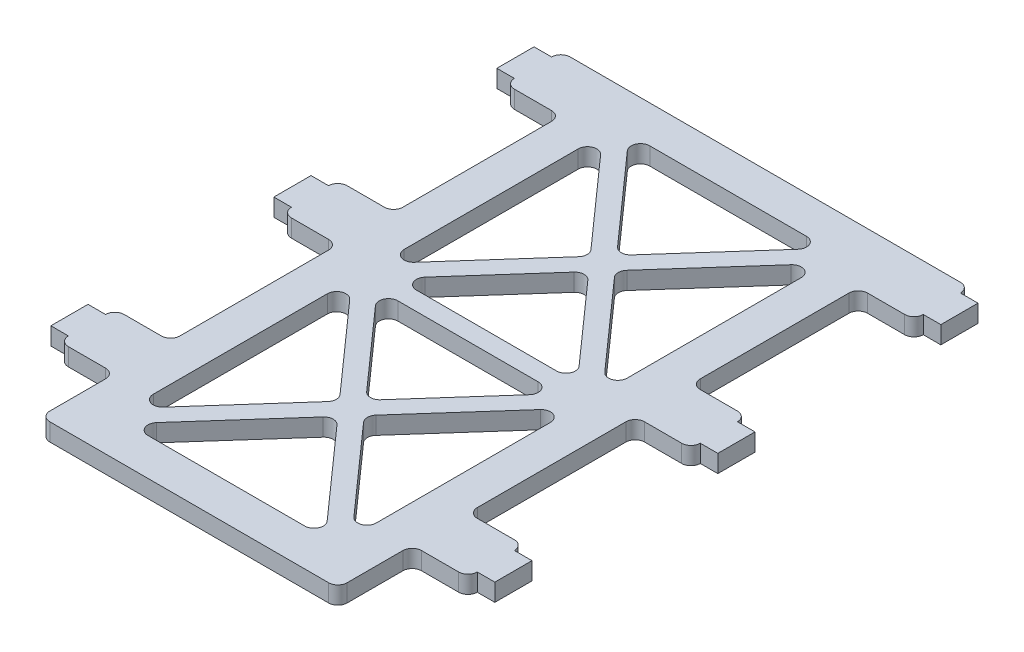
from build123d import *

# Parameters (mm, degrees)
SKETCH1_W           = 50.8
SKETCH1_H           = 98.425
BOSS_EXTRUDE1_DEPTH = 1.5
SKETCH2_W           = 9.525
SKETCH2_H           = 9.525
BOSS_EXTRUDE2_DEPTH = 3
CUT_EXTRUDE1_DEPTH  = 3
FILLET1_R           = 1.5875
SKETCH5_W           = 3
SKETCH5_H           = 6.35
BOSS_EXTRUDE3_DEPTH = 3


with BuildPart() as part:
    # Sketch1 → Boss-Extrude1 (new, symmetric)
    with BuildSketch(Plane(origin=(0, 34.29, 0), x_dir=(1, 0, 0), z_dir=(0, 1, 0))):
        with Locations((0, 120.65)):
            Rectangle(SKETCH1_W, SKETCH1_H)
    extrude(amount=BOSS_EXTRUDE1_DEPTH, both=True)

    # Sketch2 → Boss-Extrude2 (add)
    with BuildSketch(Plane(origin=(0, 35.79, 0), x_dir=(1, 0, 0), z_dir=(0, 1, 0))):
        with Locations((30.1625, 165.1)):
            Rectangle(SKETCH2_W, SKETCH2_H)
        with Locations((-30.1625, 165.1)):
            Rectangle(SKETCH2_W, SKETCH2_H)
        with Locations((30.1625, 127)):
            Rectangle(SKETCH2_W, SKETCH2_H)
        with Locations((-30.1625, 127)):
            Rectangle(SKETCH2_W, SKETCH2_H)
        with Locations((30.1625, 88.9)):
            Rectangle(SKETCH2_W, SKETCH2_H)
        with Locations((-30.1625, 88.9)):
            Rectangle(SKETCH2_W, SKETCH2_H)
    extrude(amount=-BOSS_EXTRUDE2_DEPTH)

    # Sketch4 → Cut-Extrude1 (cut)
    with BuildSketch(Plane(origin=(0, 35.79, 0), x_dir=(1, 0, 0), z_dir=(0, 1, 0))):
        Polygon((16.925996512, 163.5125), (-16.925996512, 163.5125), (0, 144.470753924), align=None)
        Polygon((-2.124003488, 142.08125), (-19.05, 161.122996076), (-19.05, 123.039503924), align=None)
        Polygon((19.05, 161.122996076), (2.124003488, 142.08125), (19.05, 123.039503924), align=None)
        Polygon((15.514885401, 122.2375), (0, 139.691746076), (-15.514885401, 122.2375), align=None)
        Polygon((-2.124003488, 99.21875), (-19.05, 118.260496076), (-19.05, 80.177003924), align=None)
        Polygon((15.514885401, 119.0625), (-15.514885401, 119.0625), (0, 101.608253924), align=None)
        Polygon((19.05, 80.177003924), (19.05, 118.260496076), (2.124003488, 99.21875), align=None)
        Polygon((16.925996512, 77.7875), (0, 96.829246076), (-16.925996512, 77.7875), align=None)
    extrude(amount=-CUT_EXTRUDE1_DEPTH, mode=Mode.SUBTRACT)

    # Fillet1
    fillet1_edges = [part.edges().sort_by_distance(p)[0] for p in [
        (15.514885401, 34.29, -122.2375),
        (-15.514885401, 34.29, -122.2375),
        (0, 34.29, -139.691746076),
        (15.514885401, 34.29, -119.0625),
        (0, 34.29, -101.608253924),
        (-15.514885401, 34.29, -119.0625),
        (16.925996512, 34.29, -77.7875),
        (-16.925996512, 34.29, -77.7875),
        (0, 34.29, -96.829246076),
        (-2.124003488, 34.29, -99.21875),
        (-19.05, 34.29, -80.177003924),
        (-19.05, 34.29, -118.260496076),
        (-2.124003488, 34.29, -142.08125),
        (-19.05, 34.29, -123.039503924),
        (-19.05, 34.29, -161.122996076),
        (19.05, 34.29, -123.039503924),
        (2.124003488, 34.29, -142.08125),
        (19.05, 34.29, -161.122996076),
        (0, 34.29, -144.470753924),
        (-16.925996512, 34.29, -163.5125),
        (16.925996512, 34.29, -163.5125),
        (19.05, 34.29, -118.260496076),
        (19.05, 34.29, -80.177003924),
        (2.124003488, 34.29, -99.21875),
        (34.925, 34.29, -84.1375),
        (34.925, 34.29, -93.6625),
        (25.4, 34.29, -93.6625),
        (25.4, 34.29, -84.1375),
        (-25.4, 34.29, -122.2375),
        (-25.4, 34.29, -131.7625),
        (-34.925, 34.29, -131.7625),
        (-34.925, 34.29, -122.2375),
        (34.925, 34.29, -122.2375),
        (34.925, 34.29, -131.7625),
        (25.4, 34.29, -131.7625),
        (25.4, 34.29, -122.2375),
        (-25.4, 34.29, -160.3375),
        (-34.925, 34.29, -169.8625),
        (-34.925, 34.29, -160.3375),
        (-25.4, 34.29, -84.1375),
        (-25.4, 34.29, -93.6625),
        (-34.925, 34.29, -93.6625),
        (-34.925, 34.29, -84.1375),
        (34.925, 34.29, -160.3375),
        (34.925, 34.29, -169.8625),
        (25.4, 34.29, -160.3375),
        (-25.4, 34.29, -71.4375),
        (25.4, 34.29, -71.4375),
    ]]
    fillet(fillet1_edges, radius=FILLET1_R)

    # Sketch5 → Boss-Extrude3 (add)
    with BuildSketch(Plane(origin=(0, 35.79, 0), x_dir=(1, 0, 0), z_dir=(0, 1, 0))):
        with Locations((36.425, 165.1)):
            Rectangle(SKETCH5_W, SKETCH5_H)
        with Locations((-36.425, 165.1)):
            Rectangle(SKETCH5_W, SKETCH5_H)
        with Locations((36.425, 127)):
            Rectangle(SKETCH5_W, SKETCH5_H)
        with Locations((-36.425, 127)):
            Rectangle(SKETCH5_W, SKETCH5_H)
        with Locations((36.425, 88.9)):
            Rectangle(SKETCH5_W, SKETCH5_H)
        with Locations((-36.425, 88.9)):
            Rectangle(SKETCH5_W, SKETCH5_H)
    extrude(amount=-BOSS_EXTRUDE3_DEPTH)


solid = part.part
